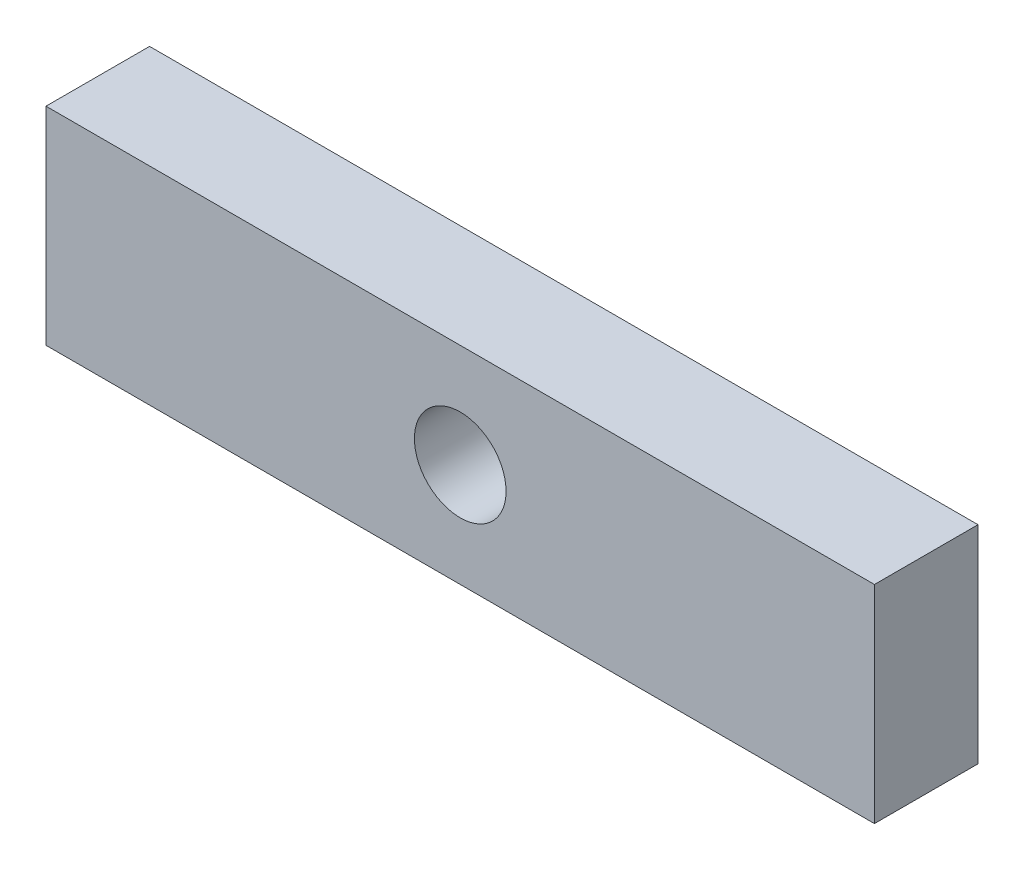
from build123d import *

# Parameters (mm, degrees)
SKETCH1_W                = 76.2
SKETCH1_H                = 19.05
BOSS_EXTRUDE1_DEPTH      = 9.525
F_5_16_CLEARANCE_HOLE1_D = 8.4328


with BuildPart() as part:
    # Sketch1 → Boss-Extrude1 (new body)
    with BuildSketch(Plane.XY):
        Rectangle(SKETCH1_W, SKETCH1_H)
    extrude(amount=BOSS_EXTRUDE1_DEPTH)

    # 5/16 Clearance Hole1 (through all)
    with Locations(Plane.XY.offset(9.525)):
        with Locations((0, 0)):
            Hole(F_5_16_CLEARANCE_HOLE1_D / 2)


solid = part.part
